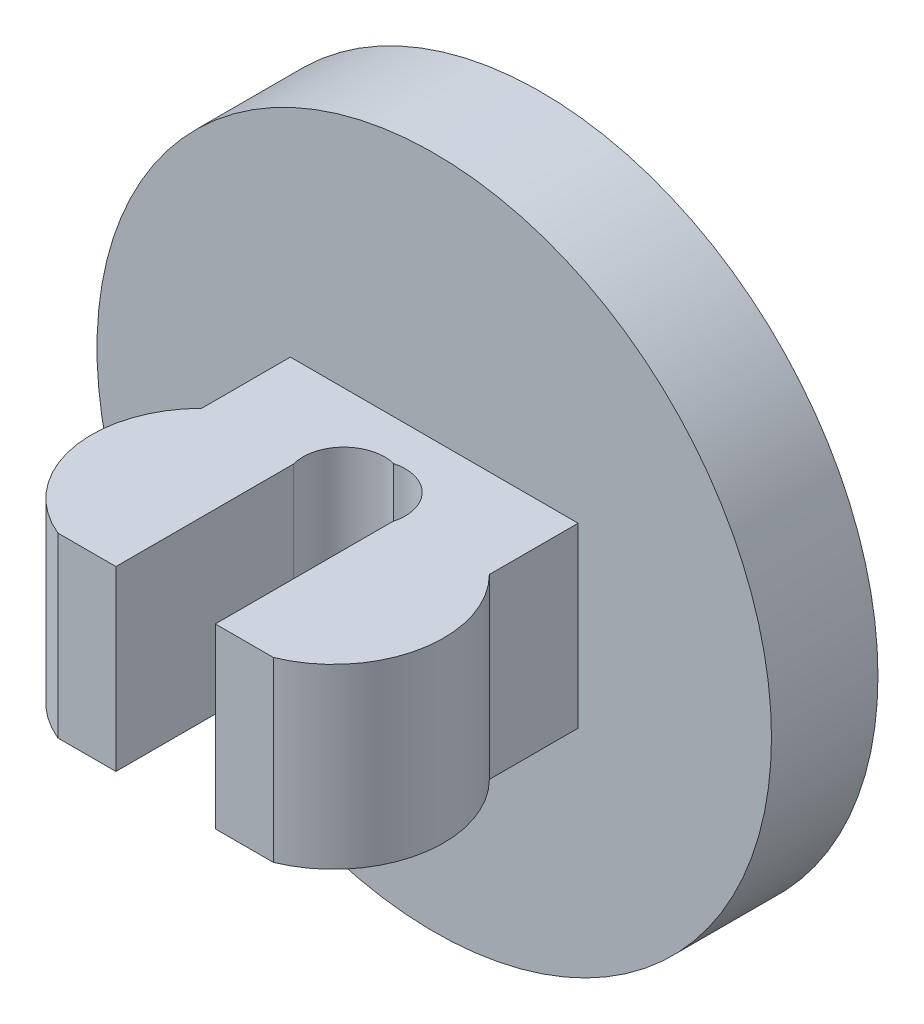
from build123d import *

# Parameters (mm, degrees)
SKETCH1_R           = 9.5
BOSS_EXTRUDE1_DEPTH = 3
BOSS_EXTRUDE2_DEPTH = 2.5


with BuildPart() as part:
    # Sketch1 → Boss-Extrude1 (new body)
    with BuildSketch(Plane.XY):
        Circle(SKETCH1_R)
    extrude(amount=BOSS_EXTRUDE1_DEPTH)

    # Sketch3 → Boss-Extrude2 (add, symmetric)
    with BuildSketch(Plane(origin=(0, 0, 0), x_dir=(1, 0, 0), z_dir=(0, 1, 0))):
        with BuildLine():
            Line((-4.053033857, -5.5), (-4.053033857, -3))
            Line((-4.053033857, -3), (4.053033857, -3))
            Line((4.053033857, -3), (4.053033857, -5.5))
            ThreePointArc((4.053033857, -5.5), (4.899562702, -8.305363596), (3.036123017, -10.566838454))
            Line((3.036123017, -10.566838454), (1.4, -10.566838454))
            Line((1.4, -10.566838454), (1.4, -5.566838454))
            ThreePointArc((1.4, -5.566838454), (1.111291087, -4.450394141), (0, -4.142444699))
            ThreePointArc((0, -4.142444699), (-1.111291087, -4.450394141), (-1.4, -5.566838454))
            Line((-1.4, -5.566838454), (-1.4, -10.566838454))
            Line((-1.4, -10.566838454), (-3.036123017, -10.566838454))
            ThreePointArc((-3.036123017, -10.566838454), (-4.899562702, -8.305363596), (-4.053033857, -5.5))
        make_face()
    extrude(amount=BOSS_EXTRUDE2_DEPTH, both=True)


solid = part.part
